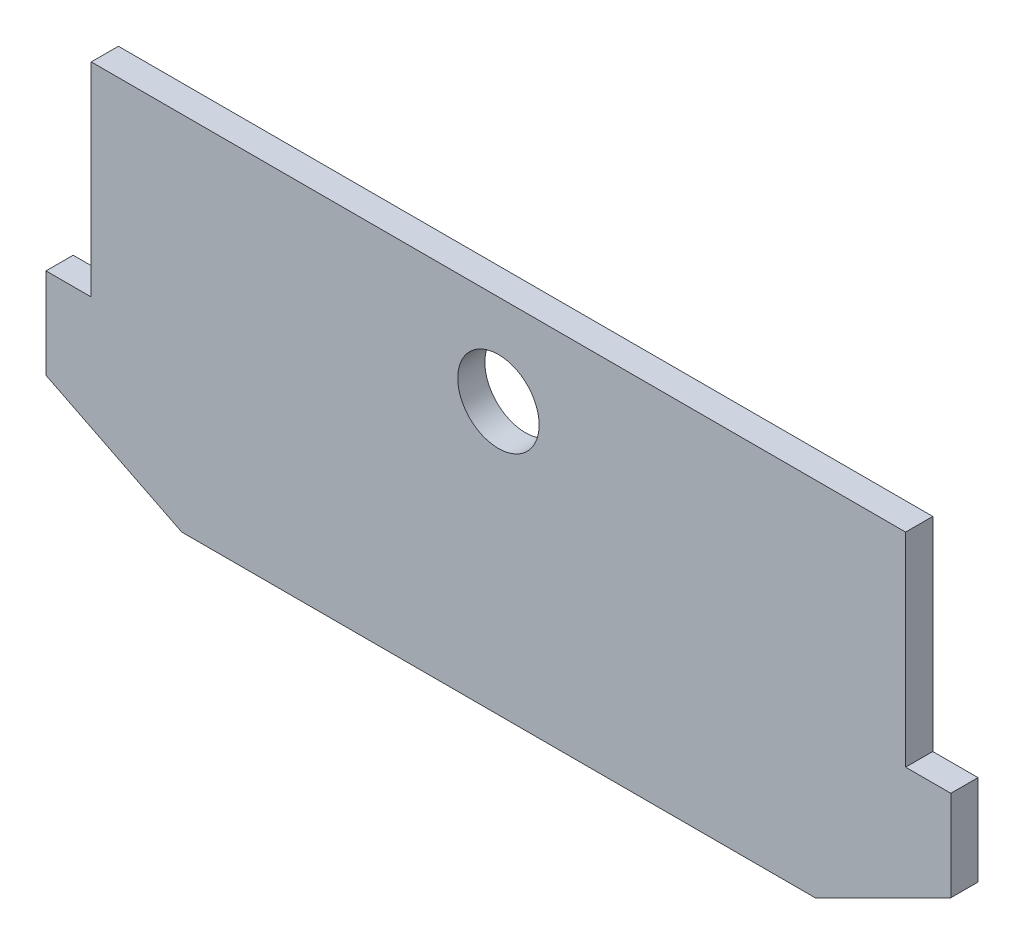
from build123d import *

# Parameters (mm, degrees)
BOSS_EXTRUDE1_DEPTH      = 3
BOSS_EXTRUDE1_DEPTH_BACK = 3
SKETCH1_R                = 9


with BuildPart() as part:
    # Sketch1 → Boss-Extrude1 (new, two sides: drawn at the far end of the back side and taken through both)
    with BuildSketch(Plane.XY.offset(-BOSS_EXTRUDE1_DEPTH_BACK)):
        Polygon((-90, 20), (90, 20), (90, -25), (100, -25), (100, -45), (70, -60), (-70, -60), (-100, -45), (-100, -25), (-90, -25), align=None)
        Circle(SKETCH1_R, mode=Mode.SUBTRACT)
    extrude(amount=BOSS_EXTRUDE1_DEPTH + BOSS_EXTRUDE1_DEPTH_BACK)


solid = part.part
